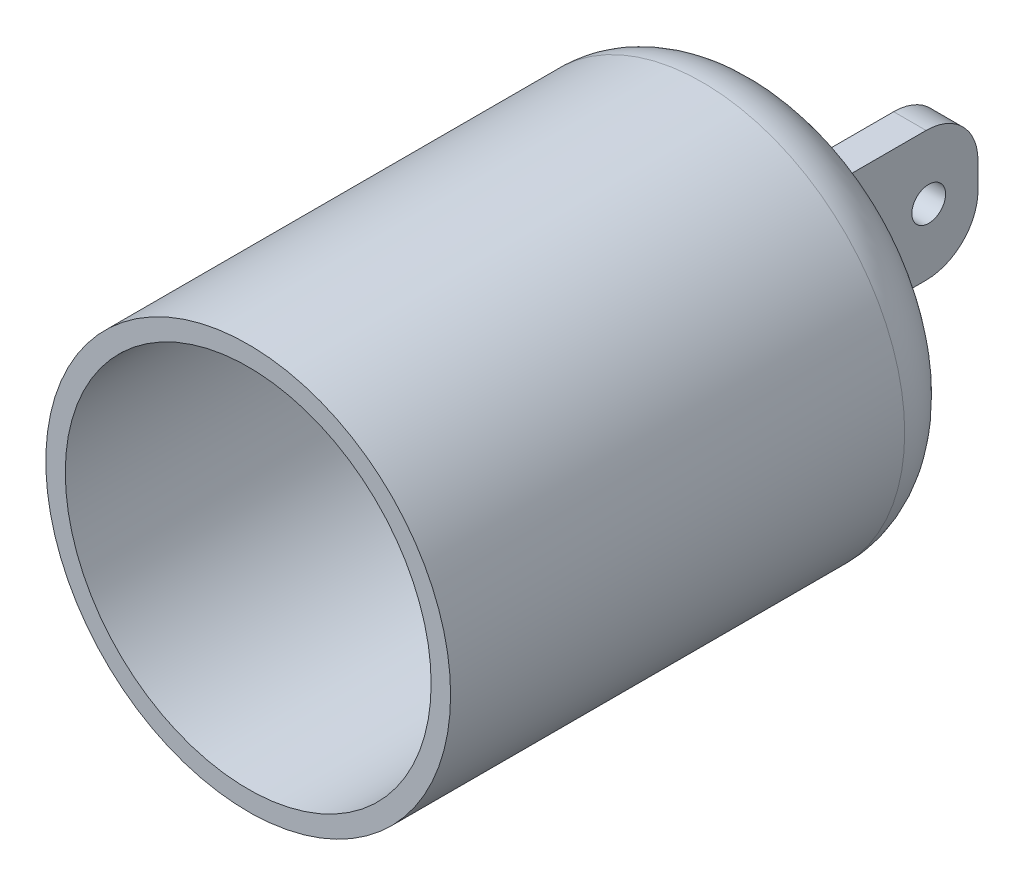
from build123d import *

# Parameters (mm, degrees)
SKETCH1_R           = 156
BOSS_EXTRUDE1_DEPTH = 400
SKETCH2_W           = 25
SKETCH2_H           = 100
BOSS_EXTRUDE2_DEPTH = 150
SKETCH3_R           = 13
CUT_EXTRUDE1_DEPTH  = 462.224728305
FILLET1_R           = 40
FILLET3_R           = 20
FILLET4_R           = 50
SHELL1_T            = -15


with BuildPart() as part:
    # Sketch1 → Boss-Extrude1 (new body)
    with BuildSketch(Plane.XY):
        Circle(SKETCH1_R)
    extrude(amount=BOSS_EXTRUDE1_DEPTH)

    # Sketch2 → Boss-Extrude2 (add)
    with BuildSketch(Plane(origin=(0, 0, 0), x_dir=(-1, 0, 0), z_dir=(0, 0, -1))):
        Rectangle(SKETCH2_W, SKETCH2_H)
    extrude(amount=BOSS_EXTRUDE2_DEPTH)

    # Sketch3 → Cut-Extrude1 (cut, through all)
    with BuildSketch(Plane(origin=(12.5, 0, 0), x_dir=(0, 0, -1), z_dir=(1, 0, 0))):
        with Locations((112, 0)):
            Circle(SKETCH3_R)
    extrude(amount=-CUT_EXTRUDE1_DEPTH, mode=Mode.SUBTRACT)

    # Fillet1
    fillet1_edges = [part.edges().sort_by_distance(p)[0] for p in [
        (0, 50, -150),
        (0, -50, -150),
    ]]
    fillet(fillet1_edges, radius=FILLET1_R)

    # Fillet3
    fillet3_edges = [part.edges().sort_by_distance(p)[0] for p in [
        (12.5, 0, 0),
        (0, -50, 0),
        (-12.5, 0, 0),
        (0, 50, 0),
    ]]
    fillet(fillet3_edges, radius=FILLET3_R)

    # Fillet4
    fillet4_edges = [part.edges().sort_by_distance(p)[0] for p in [
        (-156, 0, 0),
    ]]
    fillet(fillet4_edges, radius=FILLET4_R)

    # Shell1
    shell1_openings = [part.faces().sort_by_distance(p)[0] for p in [
        (0, 0, 400),
    ]]
    offset(amount=SHELL1_T, openings=shell1_openings)


solid = part.part
